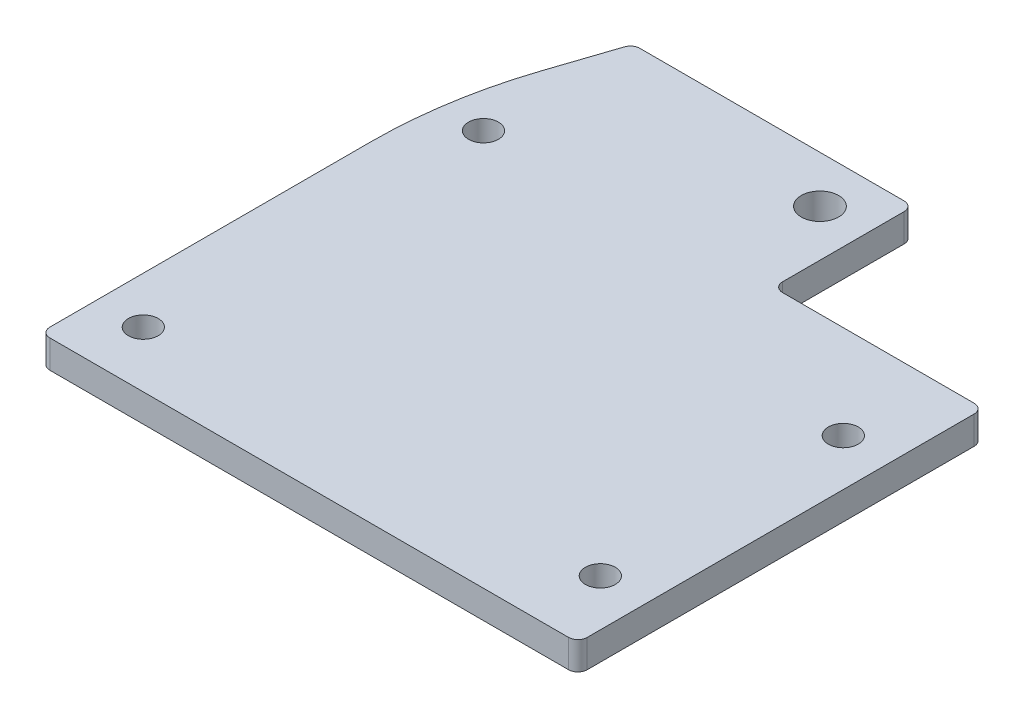
from build123d import *

# Parameters (mm, degrees)
SKETCH_1_R          = 1.6
SKETCH_1_R_2        = 2
EXTRUDE_1_DEPTH     = 3
CUT_EXTRUDE_1_DEPTH = 3
FILLET_1_R          = 50
FILLET_2_R          = 1


with BuildPart() as part:
    # ｽｹｯﾁ1 → ﾎﾞｽ - 押し出し1 (new body)
    with BuildSketch(Plane(origin=(0, 0, 0), x_dir=(1, 0, 0), z_dir=(0, 1, 0))):
        Polygon((0, 58.4), (35, 58.4), (35, 43.4), (57.5, 43.4), (57.5, 0), (0, 0), align=None)
        with Locations(Location((52.5, 7.4, 0), (0, 0, 270))):
            Circle(SKETCH_1_R, mode=Mode.SUBTRACT)
        with Locations(Location((52.5, 33.4, 0), (0, 0, 270))):
            Circle(SKETCH_1_R, mode=Mode.SUBTRACT)
        with Locations(Location((30, 53.4, 0), (0, 0, 270))):
            Circle(SKETCH_1_R_2, mode=Mode.SUBTRACT)
        with Locations(Location((5, 42.4, 0), (0, 0, 270))):
            Circle(SKETCH_1_R, mode=Mode.SUBTRACT)
        with Locations(Location((5, 6, 0), (0, 0, 90))):
            Circle(SKETCH_1_R, mode=Mode.SUBTRACT)
    extrude(amount=EXTRUDE_1_DEPTH)

    # ｽｹｯﾁ2 → ｶｯﾄ - 押し出し1 (cut)
    with BuildSketch(Plane(origin=(0, 3, 0), x_dir=(1, 0, 0), z_dir=(0, 1, 0))):
        Polygon((5, 58.4), (0, 58.4), (0, 43.4), align=None)
    extrude(amount=-CUT_EXTRUDE_1_DEPTH, mode=Mode.SUBTRACT)

    # ﾌｨﾚｯﾄ1
    fillet_1_edges = [part.edges().sort_by_distance(p)[0] for p in [
        (0, 1.5, -43.4),
    ]]
    fillet(fillet_1_edges, radius=FILLET_1_R)

    # ﾌｨﾚｯﾄ2
    fillet_2_edges = [part.edges().sort_by_distance(p)[0] for p in [
        (35, 1.5, -58.4),
        (35, 1.5, -43.4),
        (57.5, 1.5, -43.4),
        (57.5, 1.5, 0),
        (0, 1.5, 0),
        (5, 1.5, -58.4),
    ]]
    fillet(fillet_2_edges, radius=FILLET_2_R)


solid = part.part
